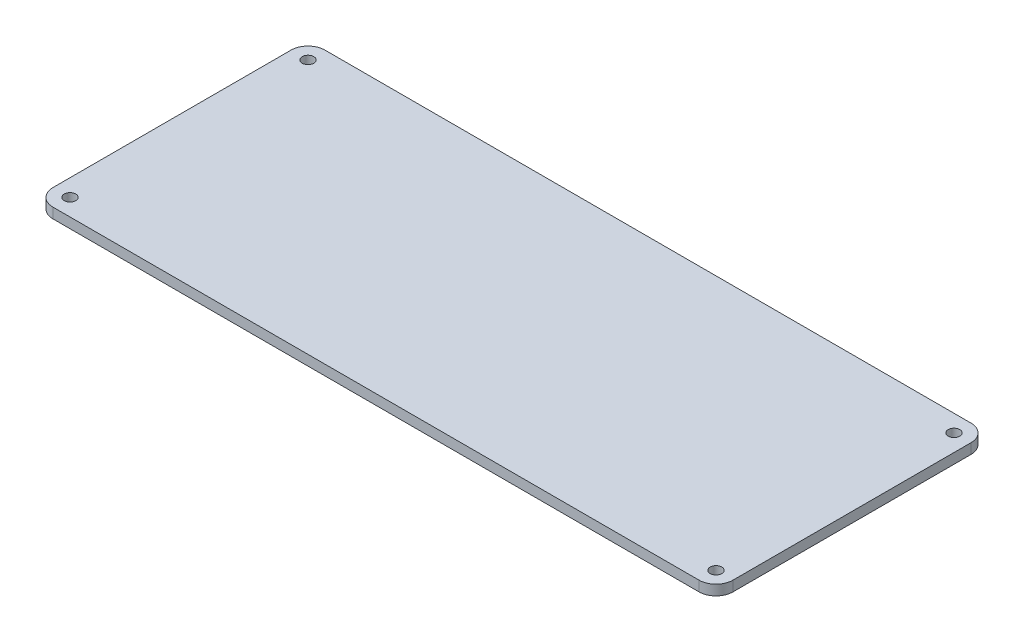
from build123d import *

# Parameters (mm, degrees)
ESQUISSE1_W             = 200
ESQUISSE1_H             = 80
BOSS_EXTRU_1_DEPTH      = 3
CONG_1_R                = 5
ESQUISSE2_R             = 1
ENL_V_MAT_EXTRU_1_DEPTH = 216.427481998
D_GAGEMENT_M31_D        = 3.4
D_GAGEMENT_M31_DEPTH    = 10
D_GAGEMENT_M31_TIP      = 1.021463052


with BuildPart() as part:
    # Esquisse1 → Boss.-Extru.1 (new body)
    with BuildSketch(Plane(origin=(0, 0, 0), x_dir=(1, 0, 0), z_dir=(0, 1, 0))):
        with Locations((100, 40)):
            Rectangle(ESQUISSE1_W, ESQUISSE1_H)
    extrude(amount=BOSS_EXTRU_1_DEPTH)

    # Congé1
    cong_1_edges = [part.edges().sort_by_distance(p)[0] for p in [
        (0, 1.5, -80),
        (200, 1.5, -80),
        (200, 1.5, 0),
        (0, 1.5, 0),
    ]]
    fillet(cong_1_edges, radius=CONG_1_R)

    # Esquisse2 → Enlèv. mat.-Extru.1 (cut, through all)
    with BuildSketch(Plane(origin=(0, 3, 0), x_dir=(1, 0, 0), z_dir=(0, 1, 0))):
        with Locations(Location((5, 75, 0), (0, 0, 270))):
            Circle(ESQUISSE2_R)
        with Locations(Location((195, 75, 0), (0, 0, 270))):
            Circle(ESQUISSE2_R)
        with Locations(Location((195, 5, 0), (0, 0, 270))):
            Circle(ESQUISSE2_R)
        with Locations(Location((5, 5, 0), (0, 0, 270))):
            Circle(ESQUISSE2_R)
    extrude(amount=-ENL_V_MAT_EXTRU_1_DEPTH, mode=Mode.SUBTRACT)

    # Dégagement M31
    with Locations(Plane(origin=(0, 3, 0), x_dir=(1, 0, 0), z_dir=(0, 1, 0))):
        with Locations((195, 5), (5, 5), (5, 75), (195, 75)):
            Hole(D_GAGEMENT_M31_D / 2, depth=D_GAGEMENT_M31_DEPTH)
            with Locations((0, 0, -(D_GAGEMENT_M31_DEPTH + D_GAGEMENT_M31_TIP / 2))):  # 118° drill point
                Cone(0, D_GAGEMENT_M31_D / 2, D_GAGEMENT_M31_TIP, mode=Mode.SUBTRACT)


solid = part.part
